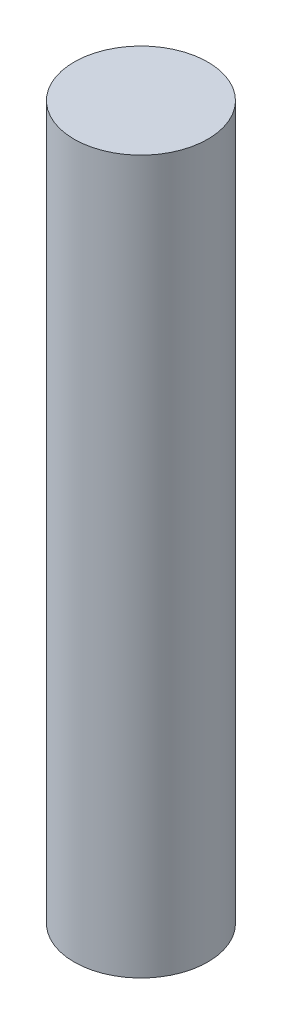
from build123d import *

# Parameters (mm, degrees)
SKETCH1_R           = 4.691340961
BOSS_EXTRUDE1_DEPTH = 50


with BuildPart() as part:
    # Sketch1 → Boss-Extrude1 (new body)
    with BuildSketch(Plane(origin=(0, 0, 0), x_dir=(1, 0, 0), z_dir=(0, 1, 0))):
        with Locations(Location((0, 0, 0), (0, 0, 270))):
            Circle(SKETCH1_R)
    extrude(amount=BOSS_EXTRUDE1_DEPTH)


solid = part.part
